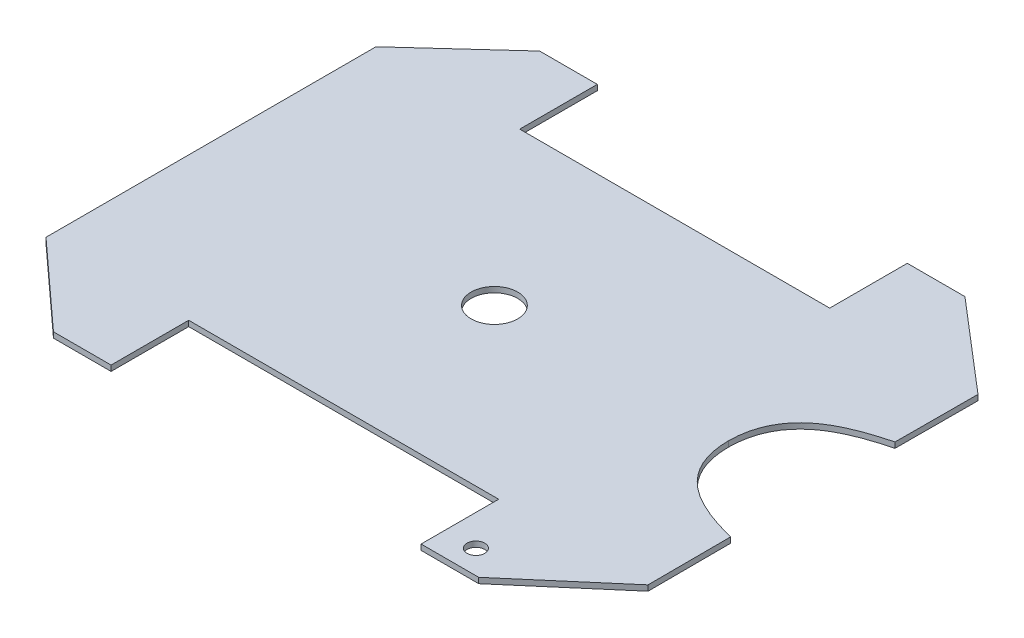
from build123d import *

# Parameters (mm, degrees)
EXTRUDE_1_DEPTH     = 5
SKETCH_2_R          = 21
CUT_EXTRUDE_1_DEPTH = 402.096820895
SKETCH1_R           = 8
CUT_EXTRUDE1_DEPTH  = 402.096820895


with BuildPart() as part:
    # Эскиз1 → Вытянуть1 (new body)
    with BuildSketch(Plane(origin=(0, 0, 0), x_dir=(1, 0, 0), z_dir=(0, 1, 0))):
        with BuildLine():
            Line((-269.7921816, 74.660680838), (-269.7921816, -223.012011978))
            Line((-269.7921816, -223.012011978), (-192.586469874, -293.492830448))
            Line((-192.586469874, -293.492830448), (-140.586469874, -293.492830448))
            Line((-140.586469874, -293.492830448), (-140.586469874, -223.492830448))
            Line((-140.586469874, -223.492830448), (139.068300868, -223.492830448))
            Line((139.068300868, -223.492830448), (139.068300868, -293.492830448))
            Line((139.068300868, -293.492830448), (191.068300868, -293.492830448))
            Line((191.068300868, -293.492830448), (273.341577689, -223.012011978))
            Line((273.341577689, -223.012011978), (273.101729514, -148.382005757))
            add(Edge.make_bspline(
                [(273.101729514, -148.382005757), (239.43664156, -139.498513163), (197.437007815, -124.724670791), (197.047353036, -74.17566557)],
                knots=[0, 0, 0, 0, 1, 1, 1, 1], degree=3))
            add(Edge.make_bspline(
                [(273.101729514, 0.030674617), (239.43664156, -8.852817977), (197.437007815, -23.62666035), (197.047353036, -74.17566557)],
                knots=[0, 0, 0, 0, 1, 1, 1, 1], degree=3))
            Line((273.101729514, 0.030674617), (273.341577689, 74.660680838))
            Line((273.341577689, 74.660680838), (191.068300868, 145.141499308))
            Line((191.068300868, 145.141499308), (139.068300868, 145.141499308))
            Line((139.068300868, 145.141499308), (139.068300868, 75.141499308))
            Line((139.068300868, 75.141499308), (-140.586469874, 75.141499308))
            Line((-140.586469874, 75.141499308), (-140.586469874, 145.141499308))
            Line((-140.586469874, 145.141499308), (-192.586469874, 145.141499308))
            Line((-192.586469874, 145.141499308), (-269.7921816, 74.660680838))
        make_face()
    extrude(amount=EXTRUDE_1_DEPTH)

    # Эскиз2 → Вырез-Вытянуть1 (cut, through all)
    with BuildSketch(Plane(origin=(0, 5, 0), x_dir=(-1, 0, 0), z_dir=(0, 1, 0))):
        with Locations(Location((14.229950912, 74.026657254, 0), (0, 0, 90))):
            Circle(SKETCH_2_R)
    extrude(amount=-CUT_EXTRUDE_1_DEPTH, mode=Mode.SUBTRACT)

    # Sketch1 → Cut-Extrude1 (cut, through all)
    with BuildSketch(Plane(origin=(0, 5, 0), x_dir=(1, 0, 0), z_dir=(0, 1, 0))):
        with Locations(Location((167.052967516, -272.065876514, 0), (0, 0, 270))):
            Circle(SKETCH1_R)
    extrude(amount=-CUT_EXTRUDE1_DEPTH, mode=Mode.SUBTRACT)


solid = part.part
